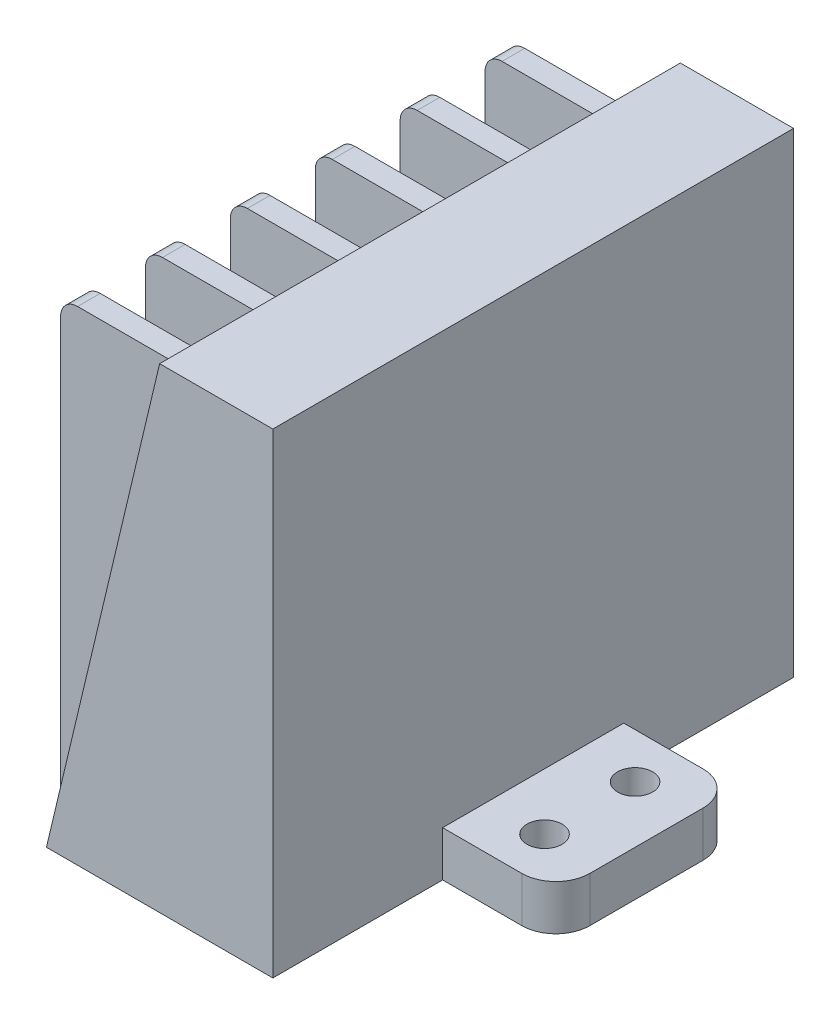
from build123d import *

# Parameters (mm, degrees)
BOSS_EXTRUDE1_DEPTH = 46
BOSS_EXTRUDE2_DEPTH = 2
LPATTERN1_COUNT     = 6
LPATTERN1_PITCH     = 7.5
SKETCH3_W           = 10
SKETCH3_H           = 4
BOSS_EXTRUDE3_DEPTH = 8
CUT_EXTRUDE1_REACH  = 65.592
SKETCH4_R           = 1.55
FILLET1_R           = 3


with BuildPart() as part:
    # Sketch1 → Boss-Extrude1 (new body)
    with BuildSketch(Plane.XY):
        Polygon((0, 0), (0, 42), (-10, 42), (-20, 0), align=None)
    extrude(amount=BOSS_EXTRUDE1_DEPTH)

    # Sketch2 → Boss-Extrude2 (add)
    with BuildSketch(Plane.XY.offset(42.75)):
        with BuildLine():
            Line((-10.595238095, 39.5), (-20.5, 39.5))
            ThreePointArc((-20.5, 39.5), (-21.560660172, 39.060660172), (-22, 38))
            Line((-22, 38), (-22, 1.5))
            ThreePointArc((-22, 1.5), (-21.560660172, 0.439339828), (-20.5, 0))
            Line((-20.5, 0), (-20, 0))
            Line((-20, 0), (-10.595238095, 39.5))
        make_face()
    boss_extrude2 = extrude(amount=-BOSS_EXTRUDE2_DEPTH)

    # LPattern1: Boss-Extrude2 ×6
    with Locations(*[(0, 0, -i * LPATTERN1_PITCH) for i in range(1, LPATTERN1_COUNT)]):
        add(boss_extrude2)

    # Sketch3 → Boss-Extrude3 (add, symmetric)
    with BuildSketch(Plane.XY.offset(23)):
        with Locations((5, 2)):
            Rectangle(SKETCH3_W, SKETCH3_H)
    extrude(amount=BOSS_EXTRUDE3_DEPTH, both=True)

    # Sketch4 → Cut-Extrude1 (cut, up to next)
    with BuildSketch(Plane(origin=(0, 4, 0), x_dir=(1, 0, 0), z_dir=(0, 1, 0)), mode=Mode.PRIVATE) as cut_extrude1_sk1:
        with Locations(Location((5, -19, 0), (0, 0, 270))):
            Circle(SKETCH4_R)
    cut_extrude1_tool1 = extrude(cut_extrude1_sk1.sketch, amount=-CUT_EXTRUDE1_REACH, mode=Mode.PRIVATE) & part.part
    # Sketch4 → Cut-Extrude1 (cut, up to next)
    with BuildSketch(Plane(origin=(0, 4, 0), x_dir=(1, 0, 0), z_dir=(0, 1, 0)), mode=Mode.PRIVATE) as cut_extrude1_sk2:
        with Locations(Location((5, -27, 0), (0, 0, 270))):
            Circle(SKETCH4_R)
    cut_extrude1_tool2 = extrude(cut_extrude1_sk2.sketch, amount=-CUT_EXTRUDE1_REACH, mode=Mode.PRIVATE) & part.part
    add(cut_extrude1_tool1.solids().sort_by_distance((5, 4, 19))[0], mode=Mode.SUBTRACT)
    add(cut_extrude1_tool2.solids().sort_by_distance((5, 4, 27))[0], mode=Mode.SUBTRACT)

    # Fillet1
    fillet1_edges = [part.edges().sort_by_distance(p)[0] for p in [
        (10, 2, 15),
        (10, 2, 31),
    ]]
    fillet(fillet1_edges, radius=FILLET1_R)


solid = part.part
